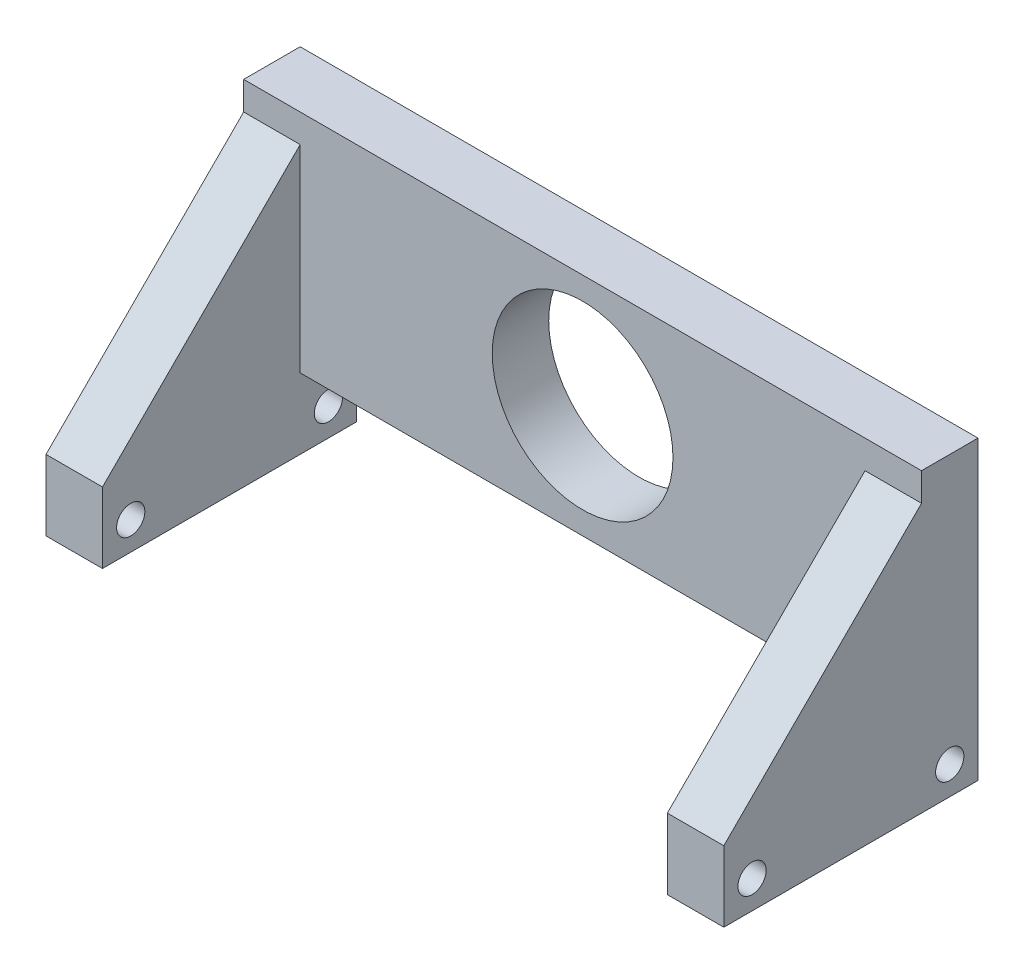
from build123d import *

# Parameters (mm, degrees)
SKETCH2_W           = 100
SKETCH2_H           = 40
BOSS_EXTRUDE1_DEPTH = 10
SKETCH3_R           = 7.5
CUT_EXTRUDE1_DEPTH  = 55.772255751
SKETCH4_R           = 16
CUT_EXTRUDE2_DEPTH  = 55.772255751
SKETCH5_R           = 2.5
BOSS_EXTRUDE2_DEPTH = 10


with BuildPart() as part:
    # Sketch2 → Boss-Extrude1 (new body)
    with BuildSketch(Plane.XY):
        Rectangle(SKETCH2_W, SKETCH2_H)
    extrude(amount=BOSS_EXTRUDE1_DEPTH)

    # Sketch3 → Cut-Extrude1 (cut, through all)
    with BuildSketch(Plane.XY.offset(10)):
        Circle(SKETCH3_R)
    extrude(amount=-CUT_EXTRUDE1_DEPTH, mode=Mode.SUBTRACT)

    # Sketch4 → Cut-Extrude2 (cut, through all)
    with BuildSketch(Plane.XY.offset(10)):
        Circle(SKETCH4_R)
    extrude(amount=-CUT_EXTRUDE2_DEPTH, mode=Mode.SUBTRACT)

    # Sketch5 → Boss-Extrude2 (add)
    with BuildSketch(Plane.ZY.offset(50)):
        Polygon((0, 20), (10, 20), (10, 15), (45, -20), (45, -32.5), (10, -32.5), (0, -32.5), align=None)
        with Locations((5, -27.5)):
            Circle(SKETCH5_R, mode=Mode.SUBTRACT)
        with Locations((40, -27.5)):
            Circle(SKETCH5_R, mode=Mode.SUBTRACT)
    boss_extrude2 = extrude(amount=BOSS_EXTRUDE2_DEPTH)

    # Mirror1: Boss-Extrude2 across plane
    add(boss_extrude2.mirror(Plane(origin=(0, 0, 0), x_dir=(0, 0, 1), z_dir=(1, 0, 0))))


solid = part.part
